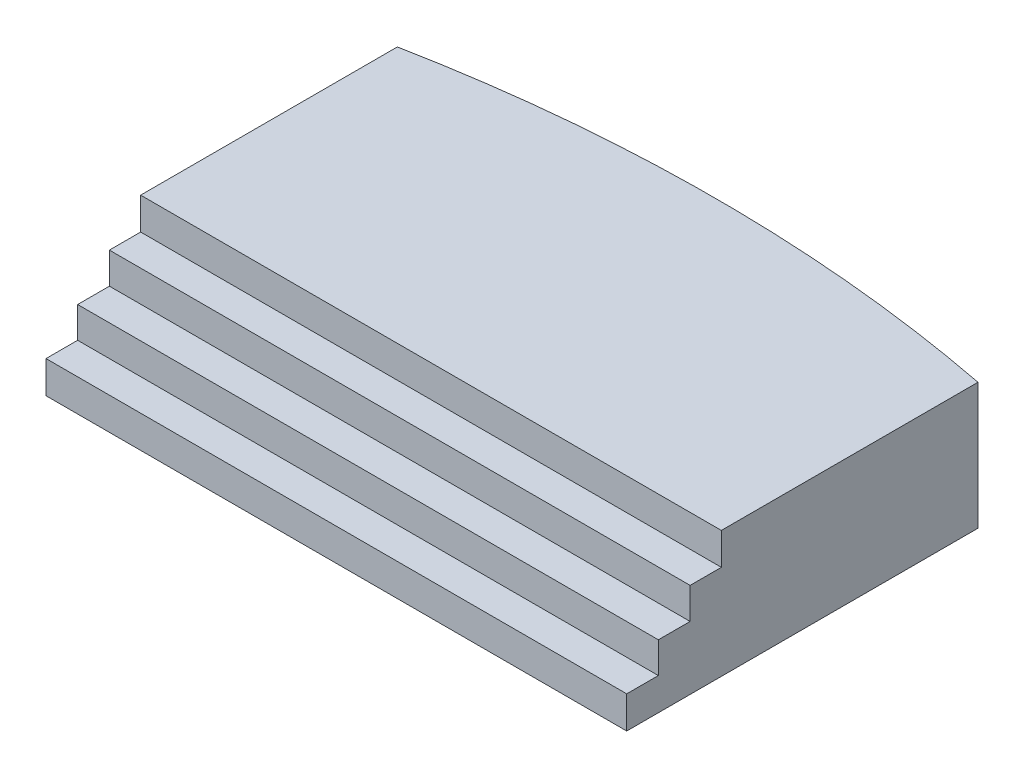
from build123d import *

# Parameters (mm, degrees)
BOSS_EXTRUDE1_DEPTH     = 1000
CUT_EXTRUDE1_DEPTH      = 24000
BOSS_EXTRUDE2_DEPTH     = 202.99281
CUT_EXTRUDE5_START      = -4000
CUT_EXTRUDE5_DEPTH      = 4000
CUT_EXTRUDE6_DEPTH      = 2000
CUT_EXTRUDE6_DEPTH_BACK = 2000
SKETCH9_W               = 1770.722272071
SKETCH9_H               = 3199.197131872


with BuildPart() as part:
    # Sketch1 → Boss-Extrude1 (new body)
    with BuildSketch(Plane(origin=(0, 0, 0), x_dir=(1, 0, 0), z_dir=(0, 1, 0))):
        with BuildLine():
            Line((-4067.116172071, 9000), (3864.123361974, 9000))
            Line((3864.123361974, 9000), (3864.123361974, 11360.834064603))
            ThreePointArc((3864.123361974, 11360.834064603), (1958.314482503, 11839.130220908), (0, 12000))
            ThreePointArc((0, 12000), (-2064.332945394, 11821.105256725), (-4067.116172071, 11289.754915094))
            Line((-4067.116172071, 11289.754915094), (-4067.116172071, 9000))
        make_face()
    extrude(amount=BOSS_EXTRUDE1_DEPTH)

    # Sketch2 → Cut-Extrude1 (cut)
    with BuildSketch(Plane(origin=(3864.123361974, 0, 0), x_dir=(0, 0, -1), z_dir=(1, 0, 0))):
        Polygon((9000, 254.910429711), (9250.24574489, 254.910429711), (9250.24574489, 500), (9501.411916095, 500), (9501.411916095, 747.115103928), (9748.527020023, 747.115103928), (9748.527020023, 1000), (9000, 1000), align=None)
    extrude(amount=-CUT_EXTRUDE1_DEPTH, mode=Mode.SUBTRACT)

    # Sketch4 → Boss-Extrude2 (add)
    with BuildSketch(Plane(origin=(3864.123361974, 0, 0), x_dir=(0, 0, -1), z_dir=(1, 0, 0))):
        Polygon((9000, 254.910429711), (9000, 0), (11360.834064603, 0), (11360.834064603, 1000), (9748.527020023, 1000), (9748.527020023, 747.115103928), (9501.411916095, 747.115103928), (9501.411916095, 500), (9250.24574489, 500), (9250.24574489, 254.910429711), align=None)
    extrude(amount=BOSS_EXTRUDE2_DEPTH)

    # Sketch5 → Cut-Extrude5 (cut)
    with BuildSketch(Plane(origin=(0, 1000, 0), x_dir=(1, 0, 0), z_dir=(0, 1, 0)).offset(CUT_EXTRUDE5_START)):
        with BuildLine():
            Line((4067.116172071, 11289.754915094), (4067.116171974, 11360.834064603))
            Line((4067.116171974, 11360.834064603), (3864.123361974, 11360.834064603))
            ThreePointArc((3864.123361974, 11360.834064603), (3965.779015272, 11325.749282146), (4067.116172071, 11289.754915094))
        make_face()
    extrude(amount=CUT_EXTRUDE5_DEPTH, mode=Mode.SUBTRACT)

    # Sketch9 → Cut-Extrude6 (cut, two sides: drawn at the far end of the back side and taken through both)
    with BuildSketch(Plane.XZ.offset(-CUT_EXTRUDE6_DEPTH_BACK)):
        with Locations((3181.755036035, -10599.598565936)):
            Rectangle(SKETCH9_W, SKETCH9_H)
        with Locations((-3181.755036035, -10599.598565936)):
            Rectangle(SKETCH9_W, SKETCH9_H)
    extrude(amount=CUT_EXTRUDE6_DEPTH + CUT_EXTRUDE6_DEPTH_BACK, mode=Mode.SUBTRACT)


solid = part.part
